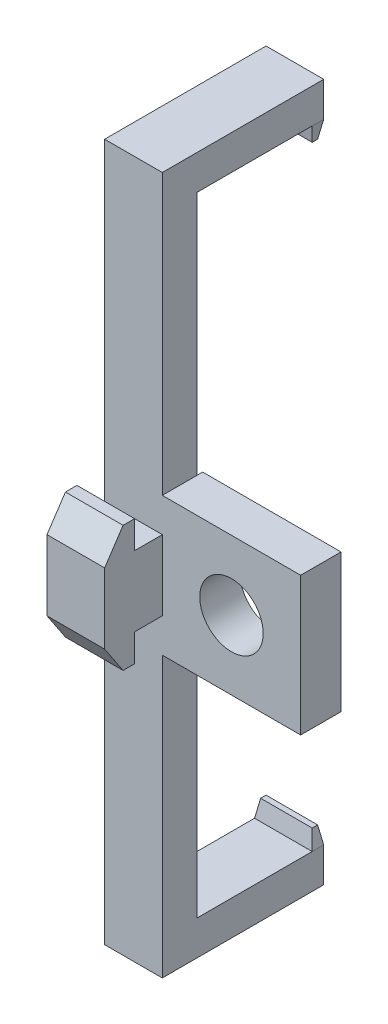
from build123d import *

# Parameters (mm, degrees)
SKETCH1_W           = 5
SKETCH1_H           = 54.5
SKETCH1_H_2         = 3
BOSS_EXTRUDE3_DEPTH = 3
SKETCH1_5_W         = 5
SKETCH1_5_H         = 3
BOSS_EXTRUDE4_DEPTH = 11
SKETCH3_W           = 5
SKETCH3_H           = 1
BOSS_EXTRUDE5_DEPTH = 1.5
BOSS_EXTRUDE5_TAPER = 10
BOSS_EXTRUDE6_DEPTH = 5
SKETCH34_W          = 3.5
SKETCH34_H          = 12
BOSS_EXTRUDE2_DEPTH = 12
CUT_EXTRUDE2_REACH  = 46.911
SKETCH4_R           = 2.75


with BuildPart() as part:
    # Sketch1 → Boss-Extrude3 (new body)
    with BuildSketch(Plane.XY):
        with Locations((-78.011372184, 0)):
            Rectangle(SKETCH1_W, SKETCH1_H)
        with Locations((-78.011372184, -28.75)):
            Rectangle(SKETCH1_W, SKETCH1_H_2)
        with Locations((-78.011372184, 28.75)):
            Rectangle(SKETCH1_W, SKETCH1_H_2)
    extrude(amount=BOSS_EXTRUDE3_DEPTH)

    # Sketch1<5> → Boss-Extrude4 (add)
    with BuildSketch(Plane.XY):
        with Locations((-78.011372184, -28.75)):
            Rectangle(SKETCH1_5_W, SKETCH1_5_H)
        with Locations((-78.011372184, 28.75)):
            Rectangle(SKETCH1_5_W, SKETCH1_5_H)
    extrude(amount=-BOSS_EXTRUDE4_DEPTH)

    # Sketch3 → Boss-Extrude5 (add)
    with BuildSketch(Plane(origin=(0, -27.25, 0), x_dir=(1, 0, 0), z_dir=(0, 1, 0))):
        with Locations((-78.011372184, 10.5)):
            Rectangle(SKETCH3_W, SKETCH3_H)
    boss_extrude5 = extrude(amount=BOSS_EXTRUDE5_DEPTH, taper=BOSS_EXTRUDE5_TAPER)

    # Mirror1: Boss-Extrude5 across plane
    add(boss_extrude5.mirror(Plane.ZX))

    # Sketch5 → Boss-Extrude6 (add)
    with BuildSketch(Plane(origin=(-75.511372184, 0, 0), x_dir=(0, 0, -1), z_dir=(1, 0, 0))):
        Polygon((-3, 9.5), (-2, 9.5), (-2, -9.5), (-3, -9.5), (-3, -3.05), (-5.4, -3.05), (-5.4, -5.45), (-6.4, -5.45), (-8, -3.05), (-8, 3.05), (-6.4, 5.45), (-5.4, 5.45), (-5.4, 3.05), (-3, 3.05), align=None)
    extrude(amount=-BOSS_EXTRUDE6_DEPTH)

    # Sketch34 → Boss-Extrude2 (add)
    with BuildSketch(Plane(origin=(-75.511372184, -10.701352109, -2.52337685), x_dir=(0, 0, -1), z_dir=(1, 0, 0))):
        with Locations((-3.77337685, 10.701352109)):
            Rectangle(SKETCH34_W, SKETCH34_H)
    extrude(amount=BOSS_EXTRUDE2_DEPTH)

    # Sketch4 → Cut-Extrude2 (cut, up to next)
    with BuildSketch(Plane(origin=(-75.511372184, -10.701352109, 3), x_dir=(1, 0, 0), z_dir=(0, 0, 1)), mode=Mode.PRIVATE) as cut_extrude2_sk1:
        with Locations((6, 10.701352109)):
            Circle(SKETCH4_R)
    cut_extrude2_tool1 = extrude(cut_extrude2_sk1.sketch, amount=-CUT_EXTRUDE2_REACH, mode=Mode.PRIVATE) & part.part
    add(cut_extrude2_tool1.solids().sort_by_distance((-69.511372, 0, 3))[0], mode=Mode.SUBTRACT)


solid = part.part
